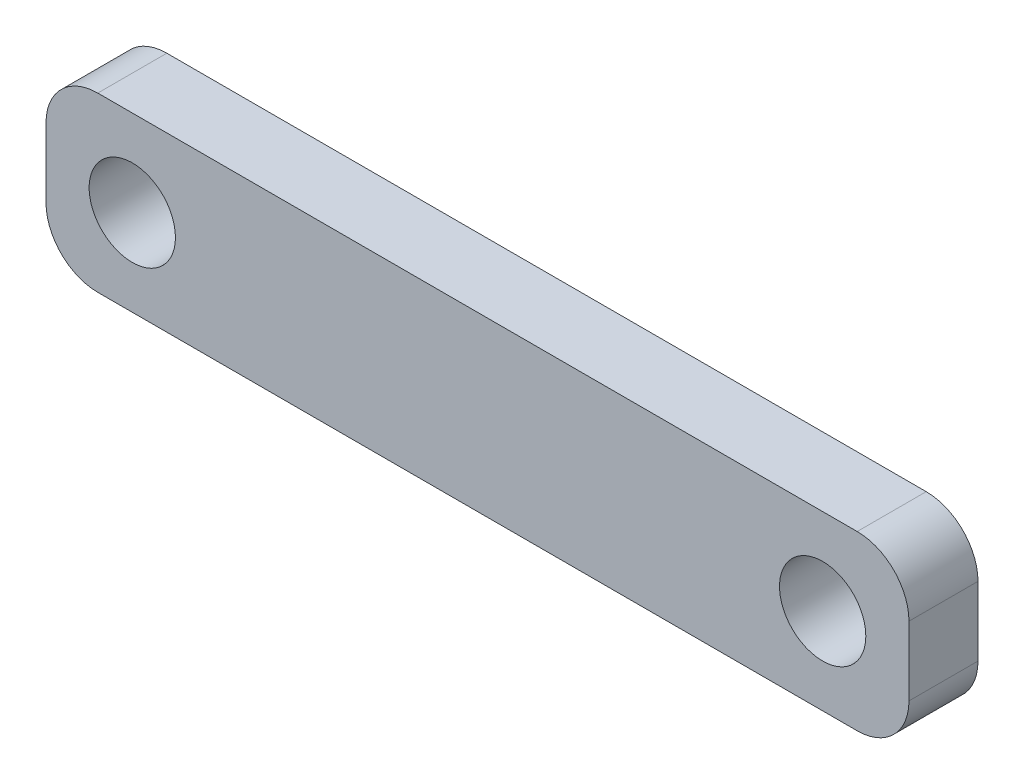
from build123d import *

# Parameters (mm, degrees)
SKETCH1_W           = 50
SKETCH1_H           = 10
SKETCH1_R           = 2.5
BOSS_EXTRUDE1_DEPTH = 4
FILLET1_R           = 3


with BuildPart() as part:
    # Sketch1 → Boss-Extrude1 (new body)
    with BuildSketch(Plane.XY):
        with Locations((-25, -5)):
            Rectangle(SKETCH1_W, SKETCH1_H)
        with Locations((-45, -5)):
            Circle(SKETCH1_R, mode=Mode.SUBTRACT)
        with Locations((-5, -5)):
            Circle(SKETCH1_R, mode=Mode.SUBTRACT)
    extrude(amount=BOSS_EXTRUDE1_DEPTH)

    # Fillet1
    fillet1_edges = [part.edges().sort_by_distance(p)[0] for p in [
        (0, 0, 2),
        (0, -10, 2),
        (-50, -10, 2),
        (-50, 0, 2),
    ]]
    fillet(fillet1_edges, radius=FILLET1_R)


solid = part.part
